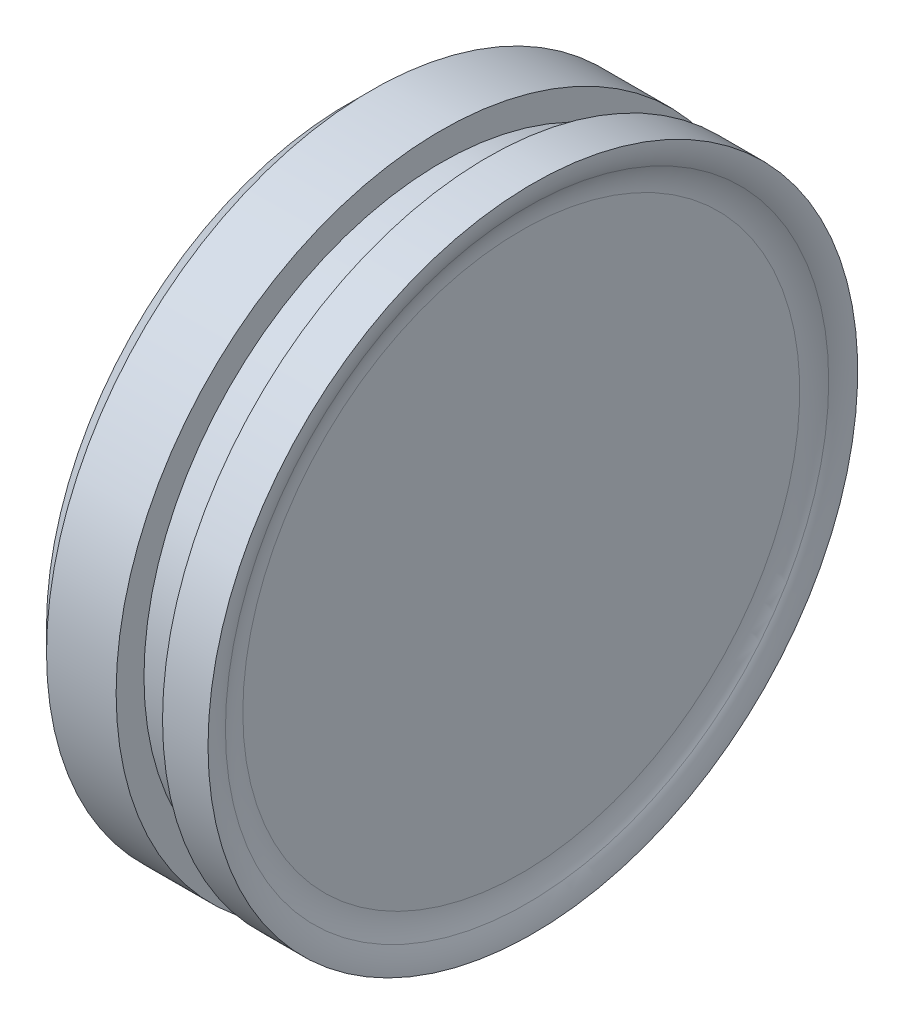
from build123d import *

# Parameters (mm, degrees)
CHAMFER1_SIZE = 0.5


with BuildPart() as part:
    # Sketch1 → Revolve1 (revolve)
    with BuildSketch(Plane.XY, mode=Mode.PRIVATE) as revolve1_sk:
        with BuildLine():
            Line((0, 0), (0, 7))
            Line((0, 7), (2, 7))
            Line((2, 7), (2, 6.4))
            Line((2, 6.4), (3, 6.4))
            Line((3, 6.4), (3, 7))
            Line((3, 7), (3.98, 7))
            ThreePointArc((3.98, 7), (3.948276406, 6.742305898), (3.855, 6.5))
            ThreePointArc((3.855, 6.5), (3.761723594, 6.257694102), (3.73, 6))
            Line((3.73, 6), (3.73, 0))
            Line((3.73, 0), (0, 0))
        make_face()
    revolve(revolve1_sk.sketch.rotate(Axis((0, 0, 0), (1, 0, 0)), 90), axis=Axis((0, 0, 0), (1, 0, 0)))

    # Chamfer1
    chamfer1_edges = [part.edges().sort_by_distance(p)[0] for p in [
        (0, 0, -7),
    ]]
    chamfer(chamfer1_edges, length=CHAMFER1_SIZE)


solid = part.part
